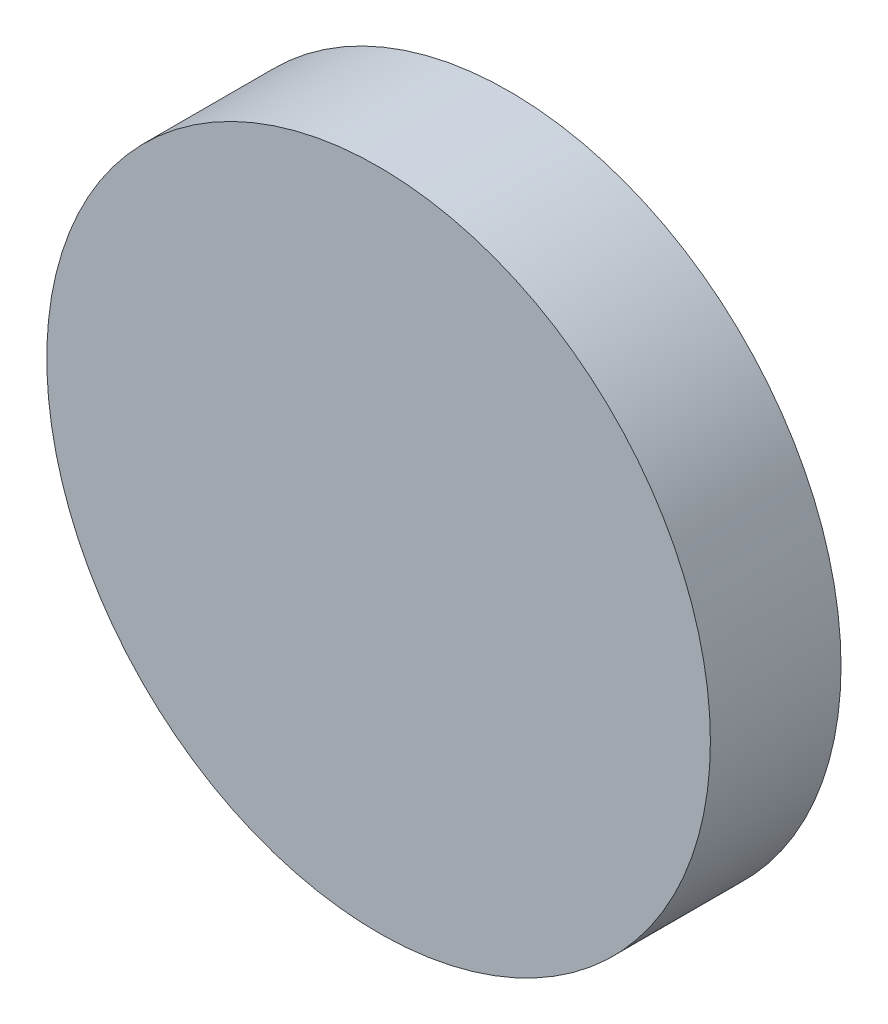
from build123d import *

# Parameters (mm, degrees)
SKETCH1_R                       = 38.1
BOSS_EXTRUDE1_DEPTH             = 15
F_3_0MM_CLEARANCE_DOWEL_HOLE1_D = 3
SHELL3_T                        = -5
BOSS_EXTRUDE2_START             = 10
SKETCH1_2_R                     = 38.1
BOSS_EXTRUDE2_DEPTH             = 5


with BuildPart() as part:
    # Sketch1 → Boss-Extrude1 (new body)
    with BuildSketch(Plane.XY):
        Circle(SKETCH1_R)
    extrude(amount=BOSS_EXTRUDE1_DEPTH)

    # Ø3.0mm Clearance Dowel Hole1 (through all)
    with Locations(Plane.XY.offset(15)):
        with Locations((0, 0)):
            Hole(F_3_0MM_CLEARANCE_DOWEL_HOLE1_D / 2)

    # Shell3
    shell3_openings = [part.faces().sort_by_distance(p)[0] for p in [
        (-37.022369265, 0, 15),
    ]]
    offset(amount=SHELL3_T, openings=shell3_openings, kind=Kind.INTERSECTION)

    # Sketch1<2> → Boss-Extrude2 (add)
    with BuildSketch(Plane.XY.offset(BOSS_EXTRUDE2_START)):
        Circle(SKETCH1_2_R)
    extrude(amount=BOSS_EXTRUDE2_DEPTH)


solid = part.part
